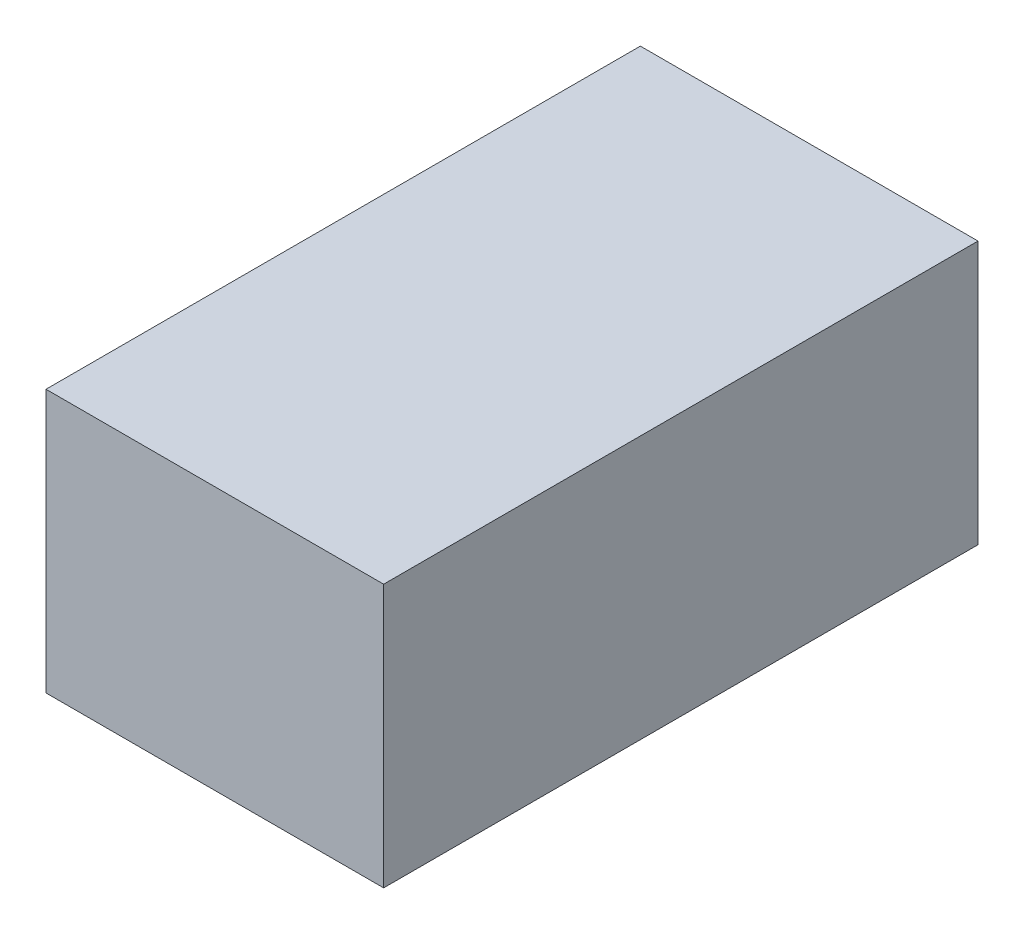
from build123d import *

# Parameters (mm, degrees)
SKETCH1_W           = 26.7
SKETCH1_H           = 20.8
BOSS_EXTRUDE1_DEPTH = 47


with BuildPart() as part:
    # Sketch1 → Boss-Extrude1 (new body)
    with BuildSketch(Plane.XY):
        Rectangle(SKETCH1_W, SKETCH1_H)
    extrude(amount=BOSS_EXTRUDE1_DEPTH)


solid = part.part
